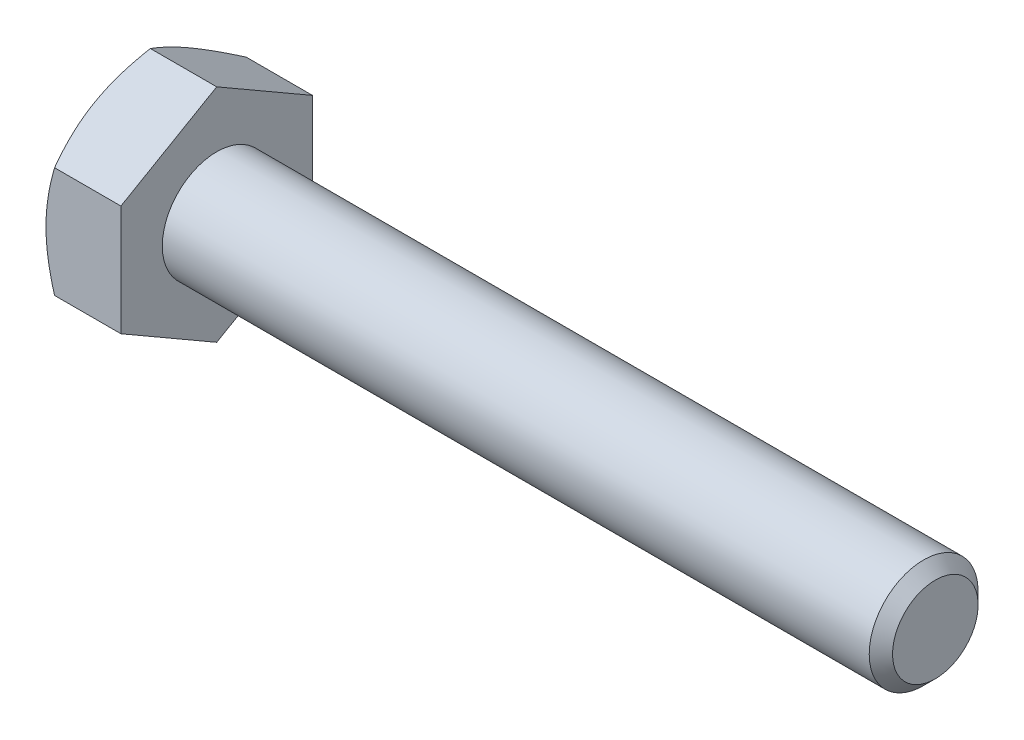
from build123d import *

# Parameters (mm, degrees)
SKETCH5_R           = 3.175
BOSS_EXTRUDE3_DEPTH = 41.91
CHAMFER1_SIZE       = 0.680357143
BOSS_EXTRUDE4_DEPTH = 4.3688
SKETCH8_OUTSIDE_W   = 189.524
SKETCH8_OUTSIDE_H   = 191.252
SKETCH8_OUTSIDE_R   = 5.588
CUT_EXTRUDE3_DEPTH  = 48.059402873
CUT_EXTRUDE3_DRAFT  = -60


with BuildPart() as part:
    # Sketch5 → Boss-Extrude3 (new body)
    with BuildSketch(Plane(origin=(23.1394, 0, 0), x_dir=(0, 0, -1), z_dir=(1, 0, 0))):
        Circle(SKETCH5_R)
    extrude(amount=-BOSS_EXTRUDE3_DEPTH)

    # Chamfer1
    chamfer1_edges = [part.edges().sort_by_distance(p)[0] for p in [
        (23.1394, 0, 3.175),
    ]]
    chamfer(chamfer1_edges, length=CHAMFER1_SIZE)

    # Sketch6 → Boss-Extrude4 (add)
    with BuildSketch(Plane.ZY.offset(18.7706)):
        Polygon((5.588, 3.226233304), (0, 6.452466608), (-5.588, 3.226233304), (-5.588, -3.226233304), (0, -6.452466608), (5.588, -3.226233304), align=None)
    extrude(amount=BOSS_EXTRUDE4_DEPTH)


with BuildPart() as cut_extrude3_tool:
    # Sketch8 outside → Cut-Extrude3 (with draft: the straight prism first)
    with BuildSketch(Plane.ZY.offset(23.1394)):
        Rectangle(SKETCH8_OUTSIDE_W, SKETCH8_OUTSIDE_H)
        Circle(SKETCH8_OUTSIDE_R, mode=Mode.SUBTRACT)
    extrude(amount=-CUT_EXTRUDE3_DEPTH)
    # Cut-Extrude3: the draft: its side faces are tilted about the plane it starts from
    cut_extrude3_sides = [cut_extrude3_tool.faces().sort_by_distance(p)[0] for p in [
        (0.890301437, -95.626, 0),
        (0.890301437, 0, 94.762),
        (0.890301437, 95.626, 0),
        (0.890301437, 0, -94.762),
        (0.890301437, 0, -5.588),
    ]]
    draft(cut_extrude3_sides, Plane.ZY.offset(23.1394), CUT_EXTRUDE3_DRAFT)


with BuildPart() as part_1:
    add(part.part)

    # Cut-Extrude3: cut by cut_extrude3_tool
    add(cut_extrude3_tool.part, mode=Mode.SUBTRACT)


solid = part_1.part
